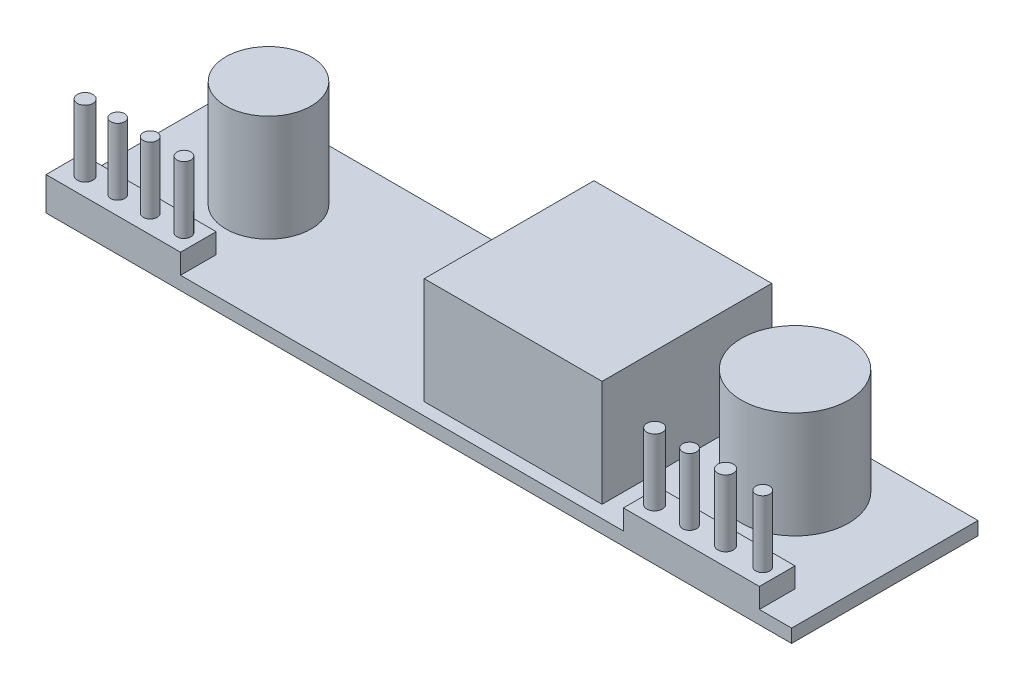
from build123d import *

# Parameters (mm, degrees)
SKETCH1_W           = 56
SKETCH1_H           = 14
BOSS_EXTRUDE1_DEPTH = 1
SKETCH2_R           = 3.20517332
SKETCH2_R_2         = 4.024260076
SKETCH2_W           = 13.356664084
SKETCH2_H           = 12.745574878
BOSS_EXTRUDE2_DEPTH = 8
SKETCH3_W           = 10.103816096
SKETCH3_H           = 2.676767311
SKETCH3_W_2         = 10.213919594
BOSS_EXTRUDE4_DEPTH = 1.5
SKETCH4_R           = 0.58561586
SKETCH4_R_2         = 0.523790748
BOSS_EXTRUDE5_DEPTH = 5


with BuildPart() as part:
    # Sketch1 → Boss-Extrude1 (new body)
    with BuildSketch(Plane(origin=(0, 0, 0), x_dir=(1, 0, 0), z_dir=(0, 1, 0))):
        with Locations((-79.072208288, 24.556101007)):
            Rectangle(SKETCH1_W, SKETCH1_H)
    extrude(amount=BOSS_EXTRUDE1_DEPTH)

    # Sketch2 → Boss-Extrude2 (add)
    with BuildSketch(Plane(origin=(0, 1, 0), x_dir=(1, 0, 0), z_dir=(0, 1, 0))):
        with Locations((-98.277869063, 25.472734817)):
            Circle(SKETCH2_R)
        with Locations((-59.779249055, 26.520316314)):
            Circle(SKETCH2_R_2)
        with Locations((-72.917666994, 24.86164561)):
            Rectangle(SKETCH2_W, SKETCH2_H)
    extrude(amount=BOSS_EXTRUDE2_DEPTH)

    # Sketch3 → Boss-Extrude4 (add)
    with BuildSketch(Plane(origin=(0, 1, 0), x_dir=(1, 0, 0), z_dir=(0, 1, 0))):
        with Locations((-102.02030024, 18.894484663)):
            Rectangle(SKETCH3_W, SKETCH3_H)
        with Locations((-58.600719871, 18.894484663)):
            Rectangle(SKETCH3_W_2, SKETCH3_H)
    extrude(amount=BOSS_EXTRUDE4_DEPTH)

    # Sketch4 → Boss-Extrude5 (add)
    with BuildSketch(Plane(origin=(0, 2.5, 0), x_dir=(1, 0, 0), z_dir=(0, 1, 0))):
        with Locations((-105.523641083, 18.948565176)):
            Circle(SKETCH4_R)
        with Locations((-103.079284257, 18.948565176)):
            Circle(SKETCH4_R_2)
        with Locations((-100.634927431, 18.948565176)):
            Circle(SKETCH4_R_2)
        with Locations((-98.103272147, 18.948565176)):
            Circle(SKETCH4_R_2)
        with Locations((-62.747396629, 18.948565176)):
            Circle(SKETCH4_R)
        with Locations((-60.128442887, 18.948565176)):
            Circle(SKETCH4_R_2)
        with Locations((-57.422190687, 18.948565176)):
            Circle(SKETCH4_R)
        with Locations((-54.628640029, 18.948565176)):
            Circle(SKETCH4_R_2)
    extrude(amount=BOSS_EXTRUDE5_DEPTH)


solid = part.part
